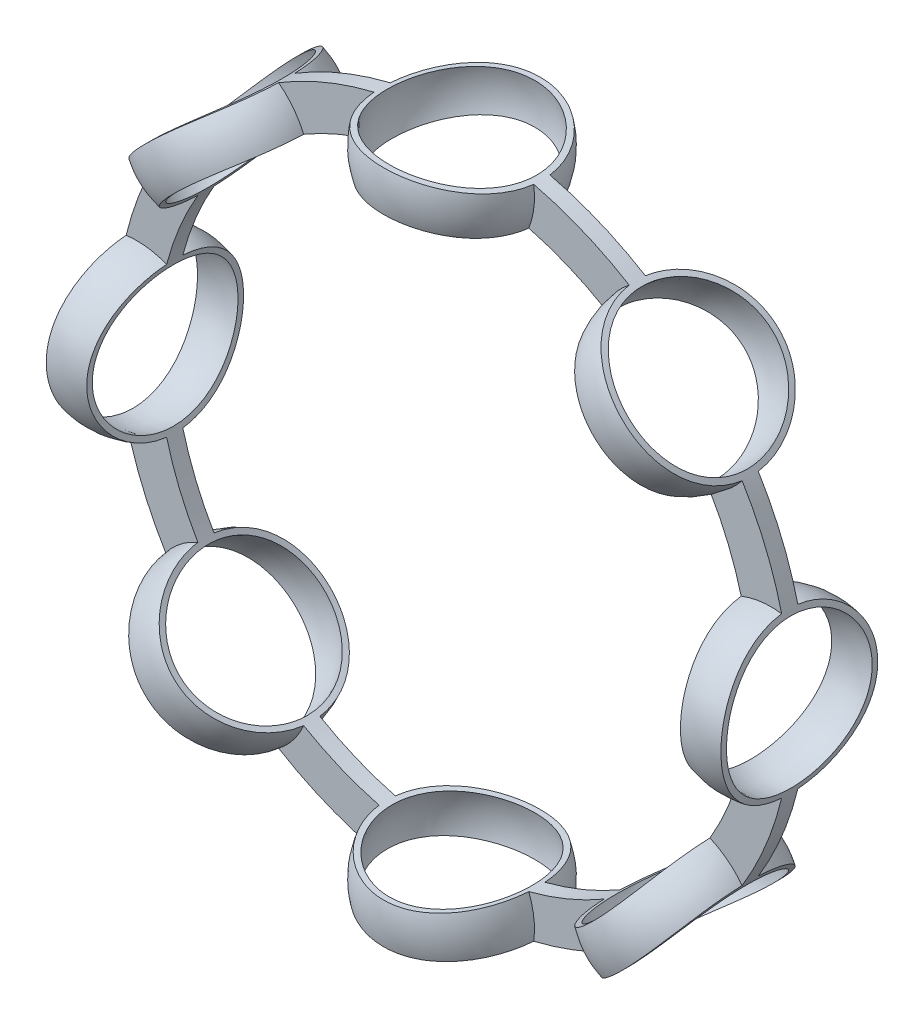
from build123d import *

# Parameters (mm, degrees)
SKETCH_1_R               = 80
EXTRUDE_1_DEPTH          = 1.5
PATTERN_CIRCULAR_1_COUNT = 8
SKETCH_5_OUTSIDE_W       = 207.65
SKETCH_5_OUTSIDE_H       = 207.65
SKETCH_5_OUTSIDE_R       = 62.5
SKETCH_5_OUTSIDE_R_2     = 55
CUT_EXTRUDE_1_DEPTH      = 35
PATTERN_CIRCULAR_2_COUNT = 8


with BuildPart() as part:
    # 草图1 → 拉伸1 (new, symmetric)
    with BuildSketch(Plane.XY):
        Circle(SKETCH_1_R)
    extrude(amount=EXTRUDE_1_DEPTH, both=True)

    # 草图4 → 旋转1 (revolve)
    with BuildSketch(Plane(origin=(0, 0, 0), x_dir=(1, 0, 0), z_dir=(0, 1, 0))):
        with BuildLine():
            Line((58.75, 15), (58.75, -15))
            ThreePointArc((58.75, -15), (73.75, 0), (58.75, 15))
        make_face()
    revolve_1 = revolve(axis=Axis((58.75, 0, -39.664192028), (0, 0, 1)))

    # 阵列(圆周)1: 旋转1 ×8 about axis
    pattern_circular_1_axis = Axis((0, 0, 0), (0, 0, 1))
    for i in range(1, PATTERN_CIRCULAR_1_COUNT):
        add(revolve_1.rotate(pattern_circular_1_axis, i * 360 / PATTERN_CIRCULAR_1_COUNT))

    # 草图5 outside → 切除-拉伸1 (cut, symmetric)
    # profile 1 of 2: a face of its own
    with BuildSketch(Plane.XY):
        Rectangle(SKETCH_5_OUTSIDE_W, SKETCH_5_OUTSIDE_H)
        with Locations(Location((0, 0, 0), (0, 0, 13.691806509))):
            Circle(SKETCH_5_OUTSIDE_R, mode=Mode.SUBTRACT)
    # profile 2 of 2: a face of its own
    with BuildSketch(Plane.XY):
        Circle(SKETCH_5_OUTSIDE_R_2)
    extrude(amount=CUT_EXTRUDE_1_DEPTH, both=True, mode=Mode.SUBTRACT)

    # 草图7 → 切除-旋转1 (revolve, cut)
    with BuildSketch(Plane(origin=(0, 0, 0), x_dir=(1, 0, 0), z_dir=(0, 1, 0))):
        with BuildLine():
            Line((58.75, 14), (58.75, -14))
            ThreePointArc((58.75, -14), (72.75, 0), (58.75, 14))
        make_face()
    cut_revolve_1 = revolve(axis=Axis((58.75, 0, -25.58024305), (0, 0, 1)), mode=Mode.SUBTRACT)

    # 阵列(圆周)2: 切除-旋转1 ×8 about axis
    pattern_circular_2_axis = Axis((0, 0, 0), (0, 0, 1))
    for i in range(1, PATTERN_CIRCULAR_2_COUNT):
        add(cut_revolve_1.rotate(pattern_circular_2_axis, i * 360 / PATTERN_CIRCULAR_2_COUNT), mode=Mode.SUBTRACT)


solid = part.part
